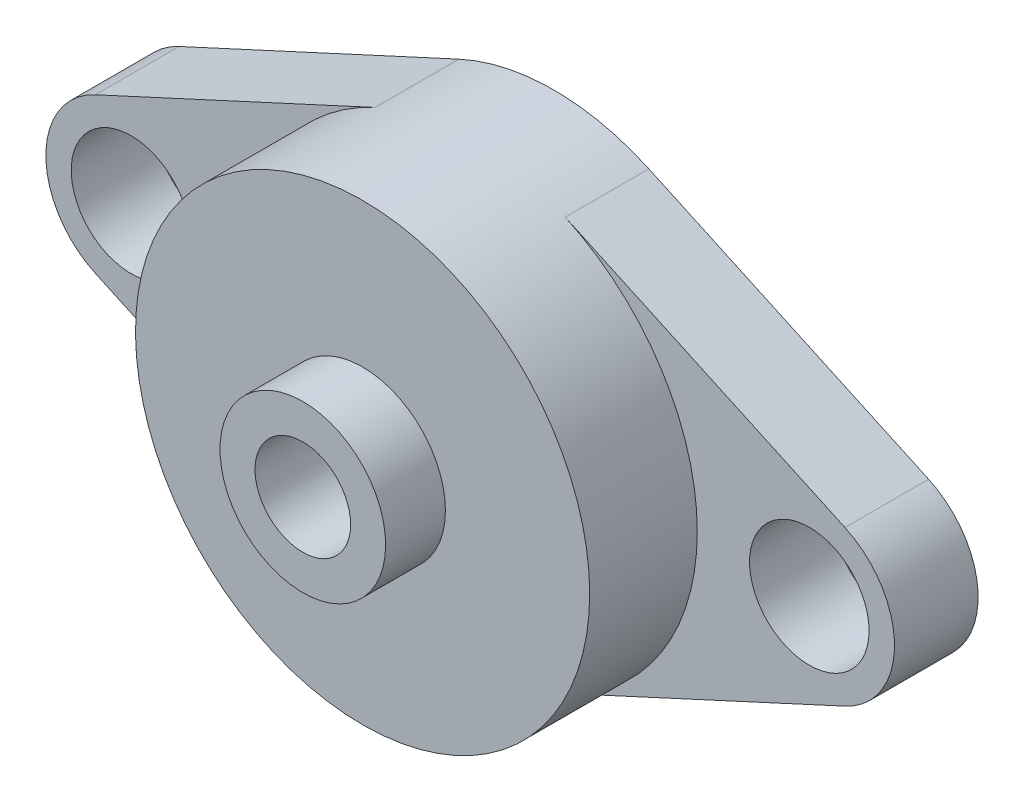
from build123d import *

# Parameters (mm, degrees)
SKETCH1_R           = 7.9375
SKETCH1_R_2         = 6.35
BOSS_EXTRUDE1_DEPTH = 5.55625
BOSS_EXTRUDE2_START = 14.2875
SKETCH2_R           = 6.35
BOSS_EXTRUDE2_DEPTH = 14.2875
SKETCH3_R           = 11
SKETCH3_R_2         = 6.35
BOSS_EXTRUDE3_DEPTH = 7.9375


with BuildPart() as part:
    # Sketch1 → Boss-Extrude1 (new, symmetric)
    with BuildSketch(Plane.XY):
        with BuildLine():
            Line((-12.623072687, 27.39405852), (-49.778964758, 10.272771945))
            ThreePointArc((-49.778964758, 10.272771945), (-56.35625, 0), (-49.778964758, -10.272771945))
            Line((-49.778964758, -10.272771945), (-12.623072687, -27.39405852))
            ThreePointArc((-12.623072687, -27.39405852), (0, -30.1625), (12.623072687, -27.39405852))
            Line((12.623072687, -27.39405852), (49.778964758, -10.272771945))
            ThreePointArc((49.778964758, -10.272771945), (56.35625, 0), (49.778964758, 10.272771945))
            Line((49.778964758, 10.272771945), (12.623072687, 27.39405852))
            ThreePointArc((12.623072687, 27.39405852), (0, 30.1625), (-12.623072687, 27.39405852))
        make_face()
        with Locations((-45.0453125, 0)):
            Circle(SKETCH1_R, mode=Mode.SUBTRACT)
        Circle(SKETCH1_R_2, mode=Mode.SUBTRACT)
        with Locations((45.0453125, 0)):
            Circle(SKETCH1_R, mode=Mode.SUBTRACT)
    extrude(amount=BOSS_EXTRUDE1_DEPTH, both=True)

    # Sketch2 → Boss-Extrude2 (add)
    with BuildSketch(Plane.XY.offset(5.55625).offset(BOSS_EXTRUDE2_START)):
        with BuildLine():
            ThreePointArc((-12.623072687, 27.39405852), (-16.263962868, -25.401966815), (30.1625, 0))
            ThreePointArc((30.1625, 0), (25.401966815, 16.263962868), (12.623072687, 27.39405852))
            ThreePointArc((12.623072687, 27.39405852), (0, 30.1625), (-12.623072687, 27.39405852))
        make_face()
        Circle(SKETCH2_R, mode=Mode.SUBTRACT)
    extrude(amount=-BOSS_EXTRUDE2_DEPTH)

    # Sketch3 → Boss-Extrude3 (add)
    with BuildSketch(Plane.XY.offset(19.84375)):
        Circle(SKETCH3_R)
        Circle(SKETCH3_R_2, mode=Mode.SUBTRACT)
    extrude(amount=BOSS_EXTRUDE3_DEPTH)


solid = part.part
